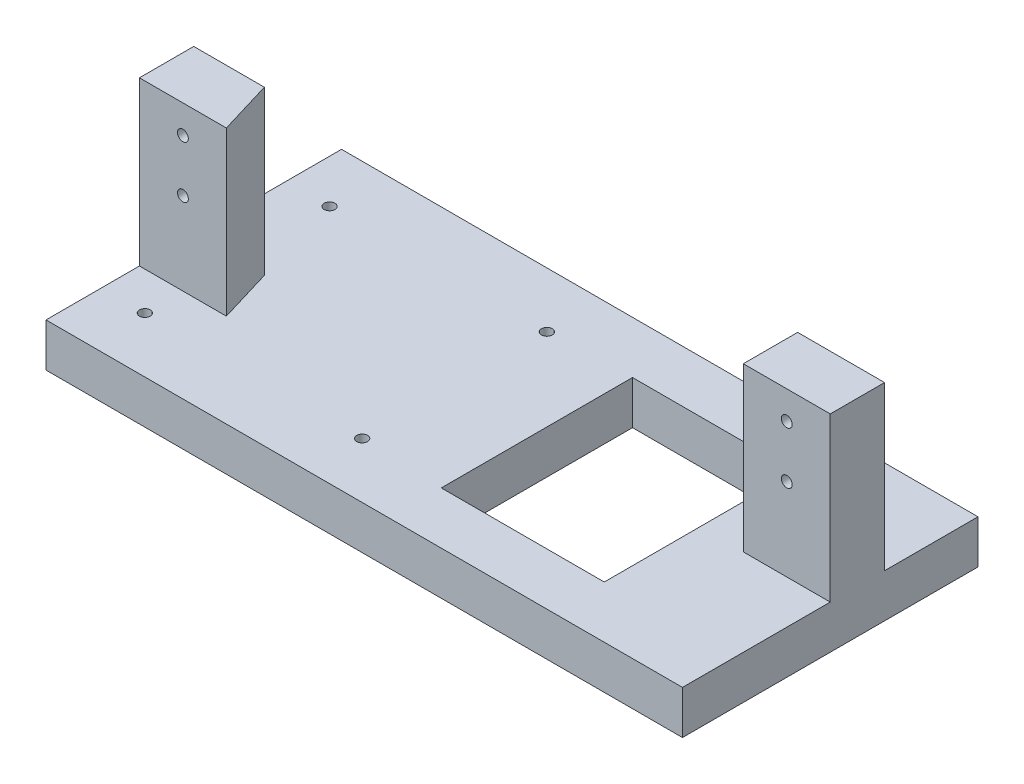
from build123d import *

# Parameters (mm, degrees)
SKETCH1_W           = 74.39914
SKETCH1_H           = 34.544
BOSS_EXTRUDE1_DEPTH = 5.08
SKETCH2_W           = 10.16
SKETCH2_H           = 6.35
BOSS_EXTRUDE2_DEPTH = 19.05
SKETCH3_R           = 0.635
CUT_EXTRUDE1_DEPTH  = 82.703658527
SKETCH4_W           = 19.05
SKETCH4_H           = 22.352
CUT_EXTRUDE2_DEPTH  = 85.210584066
SKETCH5_R           = 0.635
CUT_EXTRUDE3_DEPTH  = 86.503081048
SKETCH6_R           = 0.635
CUT_EXTRUDE4_DEPTH  = 81.098757273
CUT_EXTRUDE5_DEPTH  = 19.05


with BuildPart() as part:
    # Sketch1 → Boss-Extrude1 (new body)
    with BuildSketch(Plane(origin=(0, 0, 0), x_dir=(1, 0, 0), z_dir=(0, 1, 0))):
        with Locations((37.19957, 17.272)):
            Rectangle(SKETCH1_W, SKETCH1_H)
    extrude(amount=BOSS_EXTRUDE1_DEPTH)

    # Sketch2 → Boss-Extrude2 (add)
    with BuildSketch(Plane(origin=(0, 5.08, 0), x_dir=(1, 0, 0), z_dir=(0, 1, 0))):
        with Locations((69.31914, 20.447)):
            Rectangle(SKETCH2_W, SKETCH2_H)
        with Locations((5.08, 14.097)):
            Rectangle(SKETCH2_W, SKETCH2_H)
    extrude(amount=BOSS_EXTRUDE2_DEPTH)

    # Sketch3 → Cut-Extrude1 (cut, through all)
    with BuildSketch(Plane(origin=(0, 0, -23.622), x_dir=(-1, 0, 0), z_dir=(0, 0, -1))):
        with Locations((-69.31914, 20.828)):
            Circle(SKETCH3_R)
        with Locations((-69.31914, 14.732)):
            Circle(SKETCH3_R)
    extrude(amount=-CUT_EXTRUDE1_DEPTH, mode=Mode.SUBTRACT)

    # Sketch4 → Cut-Extrude2 (cut, through all)
    with BuildSketch(Plane(origin=(0, 5.08, 0), x_dir=(1, 0, 0), z_dir=(0, 1, 0))):
        with Locations((49.63414, 17.272)):
            Rectangle(SKETCH4_W, SKETCH4_H)
    extrude(amount=-CUT_EXTRUDE2_DEPTH, mode=Mode.SUBTRACT)

    # Sketch5 → Cut-Extrude3 (cut, through all)
    with BuildSketch(Plane(origin=(0, 0, 0), x_dir=(-1, 0, 0), z_dir=(0, -1, 0))):
        with Locations(Location((-5.08, 28.067, 0), (0, 0, 90))):
            Circle(SKETCH5_R)
        with Locations(Location((-30.48, 28.067, 0), (0, 0, 90))):
            Circle(SKETCH5_R)
        with Locations(Location((-30.48, 6.477, 0), (0, 0, 90))):
            Circle(SKETCH5_R)
        with Locations(Location((-5.08, 6.477, 0), (0, 0, 90))):
            Circle(SKETCH5_R)
    extrude(amount=-CUT_EXTRUDE3_DEPTH, mode=Mode.SUBTRACT)

    # Sketch6 → Cut-Extrude4 (cut, through all)
    with BuildSketch(Plane(origin=(0, 0, -17.272), x_dir=(-1, 0, 0), z_dir=(0, 0, -1))):
        with Locations((-5.08, 20.828)):
            Circle(SKETCH6_R)
        with Locations((-5.08, 14.732)):
            Circle(SKETCH6_R)
    extrude(amount=-CUT_EXTRUDE4_DEPTH, mode=Mode.SUBTRACT)

    # Sketch8 → Cut-Extrude5 (cut)
    with BuildSketch(Plane(origin=(0, 24.13, 0), x_dir=(1, 0, 0), z_dir=(0, 1, 0))):
        Polygon((10.16, 10.922), (8.255, 17.272), (10.16, 17.272), align=None)
    extrude(amount=-CUT_EXTRUDE5_DEPTH, mode=Mode.SUBTRACT)


solid = part.part
